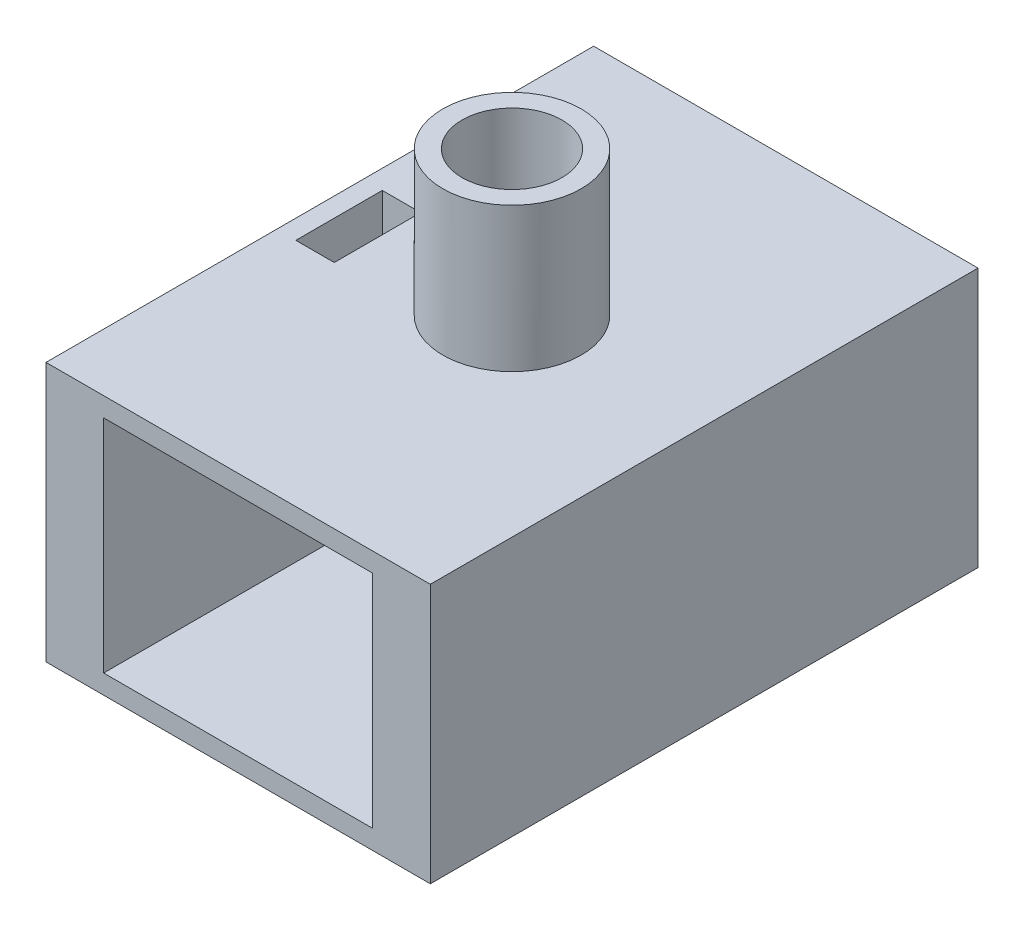
from build123d import *

# Parameters (mm, degrees)
ESQUISSE1_W             = 40
ESQUISSE1_H             = 57
BOSS_EXTRU_1_DEPTH      = 13.5
ESQUISSE5_W             = 28
ESQUISSE5_H             = 23
ENL_V_MAT_EXTRU_1_DEPTH = 55
ENL_V_MAT_EXTRU_2_REACH = 46.06
ESQUISSE6_R             = 4
ESQUISSE6_3_R           = 7.2
ESQUISSE6_3_R_2         = 5.2
BOSS_EXTRU_2_DEPTH      = 15
ESQUISSE7_W             = 4
ESQUISSE7_H             = 9
ENL_V_MAT_EXTRU_3_DEPTH = 20


with BuildPart() as part:
    # Esquisse1 → Boss.-Extru.1 (new, symmetric)
    with BuildSketch(Plane(origin=(0, 0, 0), x_dir=(1, 0, 0), z_dir=(0, 1, 0))):
        Rectangle(ESQUISSE1_W, ESQUISSE1_H)
    extrude(amount=BOSS_EXTRU_1_DEPTH, both=True)

    # Esquisse5 → Enlèv. mat.-Extru.1 (cut)
    with BuildSketch(Plane.XY.offset(28.5)):
        Rectangle(ESQUISSE5_W, ESQUISSE5_H)
    extrude(amount=-ENL_V_MAT_EXTRU_1_DEPTH, mode=Mode.SUBTRACT)

    # Esquisse6 → Enlèv. mat.-Extru.2 (cut, up to next)
    with BuildSketch(Plane(origin=(0, 13.5, 0), x_dir=(1, 0, 0), z_dir=(0, 1, 0)), mode=Mode.PRIVATE) as enl_v_mat_extru_2_sk1:
        Circle(ESQUISSE6_R)
    enl_v_mat_extru_2_tool1 = extrude(enl_v_mat_extru_2_sk1.sketch, amount=-ENL_V_MAT_EXTRU_2_REACH, mode=Mode.PRIVATE) & part.part
    add(enl_v_mat_extru_2_tool1.solids().sort_by_distance((0, 13.5, 0))[0], mode=Mode.SUBTRACT)

    # Esquisse6<3> → Boss.-Extru.2 (add)
    with BuildSketch(Plane(origin=(0, 13.5, 0), x_dir=(1, 0, 0), z_dir=(0, 1, 0))):
        Circle(ESQUISSE6_3_R)
        Circle(ESQUISSE6_3_R_2, mode=Mode.SUBTRACT)
    extrude(amount=BOSS_EXTRU_2_DEPTH)

    # Esquisse7 → Enlèv. mat.-Extru.3 (cut)
    with BuildSketch(Plane(origin=(0, 13.5, 0), x_dir=(1, 0, 0), z_dir=(0, 1, 0))):
        with Locations((-16, 0)):
            Rectangle(ESQUISSE7_W, ESQUISSE7_H)
    extrude(amount=-ENL_V_MAT_EXTRU_3_DEPTH, mode=Mode.SUBTRACT)


solid = part.part
